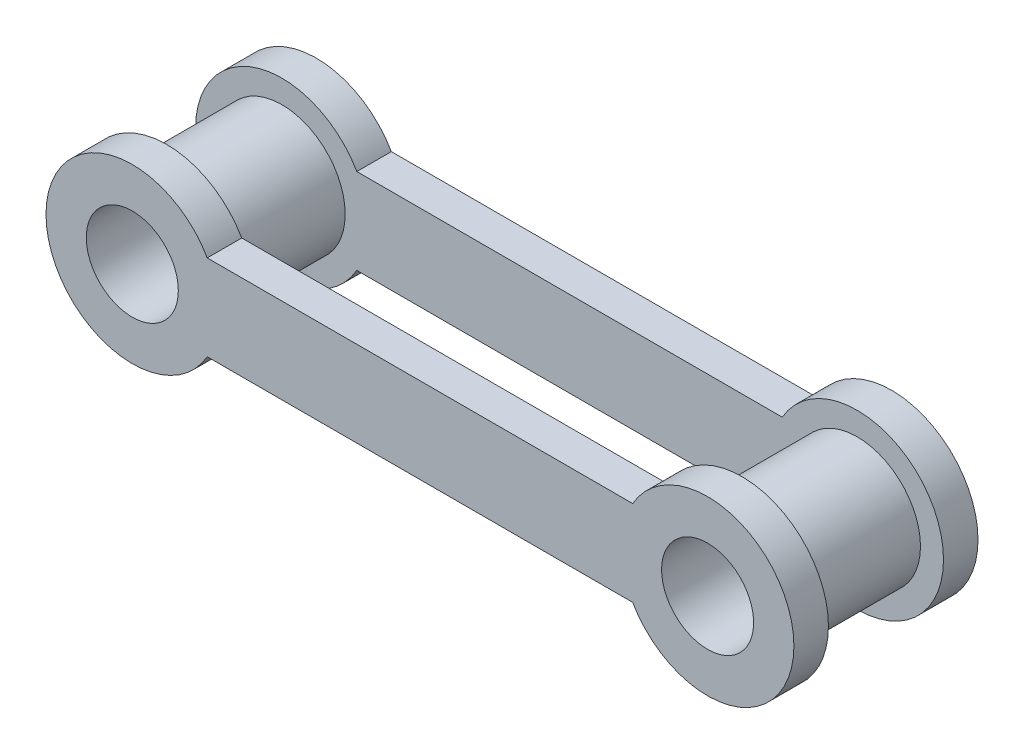
from build123d import *

# Parameters (mm, degrees)
SKETCH_1_R      = 4
EXTRUDE_1_DEPTH = 3
SKETCH_2_R      = 5.5
SKETCH_2_R_2    = 4
EXTRUDE_2_DEPTH = 10


with BuildPart() as part:
    # 草图1 → 凸台-拉伸1 (new body)
    with BuildSketch(Plane.XY):
        with BuildLine():
            Line((-6.52657961, 5.455372618), (30.448093928, 5.455372618))
            ThreePointArc((30.448093928, 5.455372618), (44.460757159, 1.735800378), (30.448093928, -1.983771861))
            Line((30.448093928, -1.983771861), (-6.52657961, -1.983771861))
            ThreePointArc((-6.52657961, -1.983771861), (-20.539242841, 1.735800378), (-6.52657961, 5.455372618))
        make_face()
        with Locations((-13.039242841, 1.735800378)):
            Circle(SKETCH_1_R, mode=Mode.SUBTRACT)
        with Locations(Location((36.960757159, 1.735800378, 0), (0, 0, 180))):
            Circle(SKETCH_1_R, mode=Mode.SUBTRACT)
    extrude_1 = extrude(amount=EXTRUDE_1_DEPTH)

    # 草图2 → 凸台-拉伸2 (add)
    # profile 1 of 2: a face of its own
    with BuildSketch(Plane.XY.offset(3)):
        with Locations((-13.039242841, 1.735800378)):
            Circle(SKETCH_2_R)
        with Locations((-13.039242841, 1.735800378)):
            Circle(SKETCH_2_R_2, mode=Mode.SUBTRACT)
    # profile 2 of 2: a face of its own
    with BuildSketch(Plane.XY.offset(3)):
        with Locations((36.960757159, 1.735800378)):
            Circle(SKETCH_2_R)
        with Locations(Location((36.960757159, 1.735800378, 0), (0, 0, 180))):
            Circle(SKETCH_2_R_2, mode=Mode.SUBTRACT)
    extrude(amount=EXTRUDE_2_DEPTH)

    # 镜向1: 凸台-拉伸1 across plane
    add(extrude_1.mirror(Plane.XY.offset(8)))


solid = part.part
